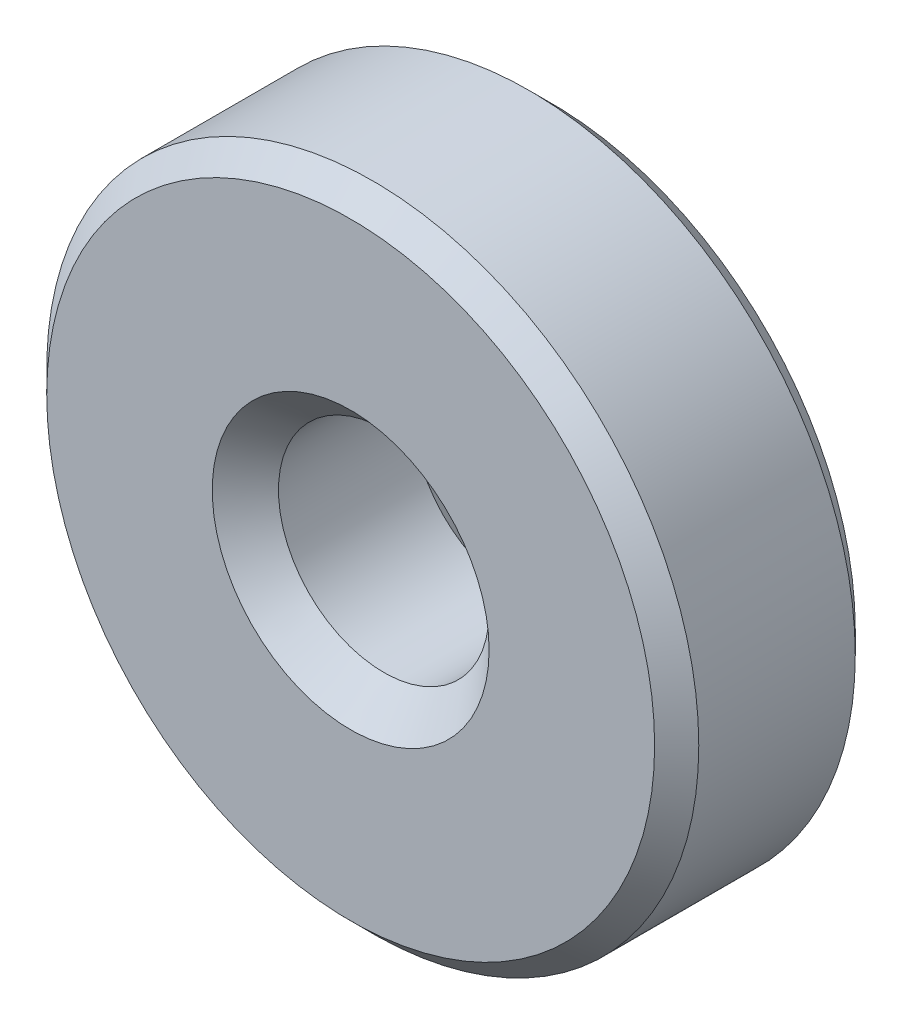
from build123d import *

# Parameters (mm, degrees)
BOSS_EXTRUDE1_DEPTH      = 2
BOSS_EXTRUDE1_DEPTH_BACK = 2
SKETCH3_R                = 6.5
SKETCH3_R_2              = 2.1
CHAMFER1_SIZE            = 0.44
CHAMFER2_SIZE            = 0.66


with BuildPart() as part:
    # Sketch3 → Boss-Extrude1 (new, two sides: drawn at the far end of the back side and taken through both)
    with BuildSketch(Plane.XY.offset(-BOSS_EXTRUDE1_DEPTH_BACK)):
        Circle(SKETCH3_R)
        Circle(SKETCH3_R_2, mode=Mode.SUBTRACT)
    extrude(amount=BOSS_EXTRUDE1_DEPTH + BOSS_EXTRUDE1_DEPTH_BACK)

    # Chamfer1
    chamfer1_edges = [part.edges().sort_by_distance(p)[0] for p in [
        (-6.5, 0, -2),
        (-6.5, 0, 2),
    ]]
    chamfer(chamfer1_edges, length=CHAMFER1_SIZE)

    # Chamfer2
    chamfer2_edges = [part.edges().sort_by_distance(p)[0] for p in [
        (-2.1, 0, -2),
        (-2.1, 0, 2),
    ]]
    chamfer(chamfer2_edges, length=CHAMFER2_SIZE)


solid = part.part
